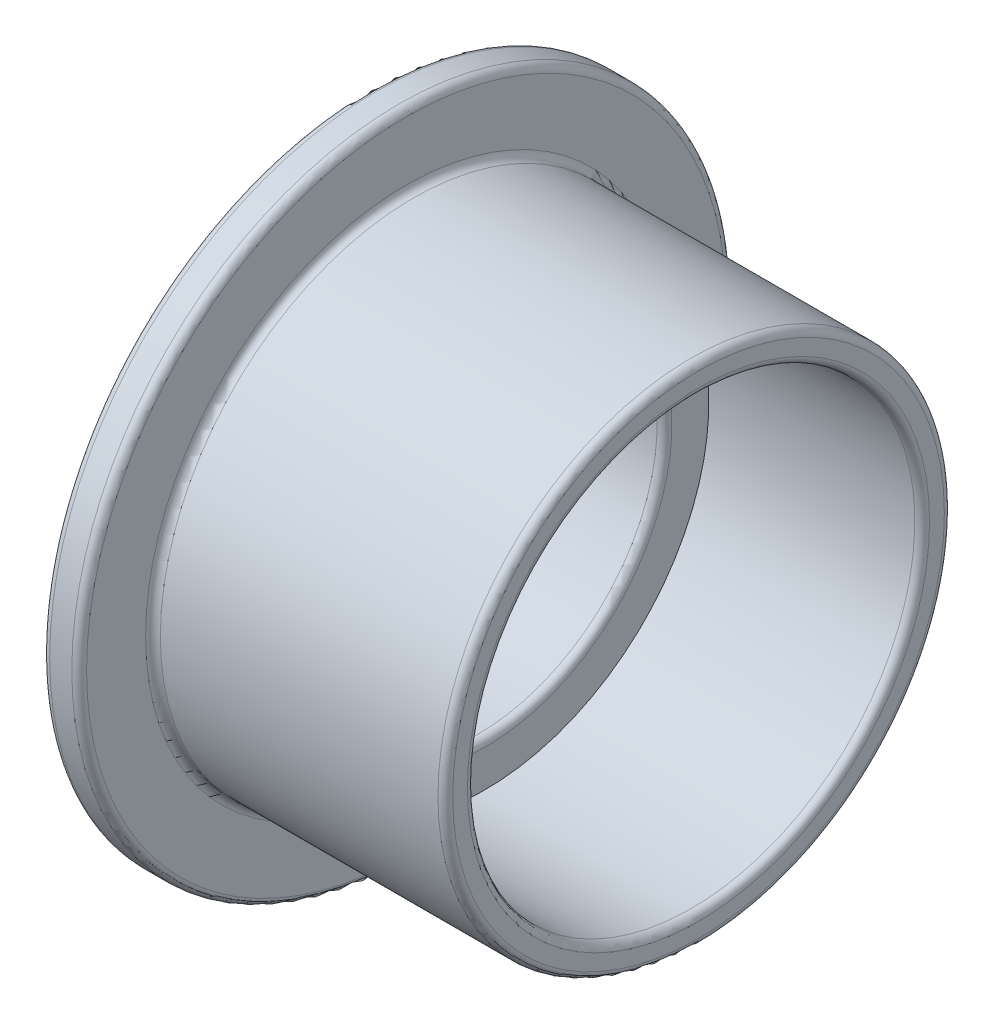
from build123d import *

# Parameters (mm, degrees)
FILLET1_R = 0.5


with BuildPart() as part:
    # Sketch1 → Revolve1 (revolve)
    with BuildSketch(Plane.XY, mode=Mode.PRIVATE) as revolve1_sk:
        Polygon((-12.5, 22.15), (-12.5, 12.15), (-4.65, 12.15), (-4.65, 15.15), (9.8, 15.15), (9.8, 17.15), (-10, 17.15), (-10, 22.15), align=None)
    revolve(revolve1_sk.sketch.rotate(Axis((-30.849638619, 0, 0), (1, 0, 0)), 90), axis=Axis((-30.849638619, 0, 0), (1, 0, 0)))

    # Fillet1
    fillet1_edges = [part.edges().sort_by_distance(p)[0] for p in [
        (-12.5, 0, -22.15),
        (-10, 0, -22.15),
        (-10, 0, -17.15),
        (9.8, 0, -17.15),
        (9.8, 0, -15.15),
        (-4.65, 0, -12.15),
        (-12.5, 0, -12.15),
    ]]
    fillet(fillet1_edges, radius=FILLET1_R)


solid = part.part
